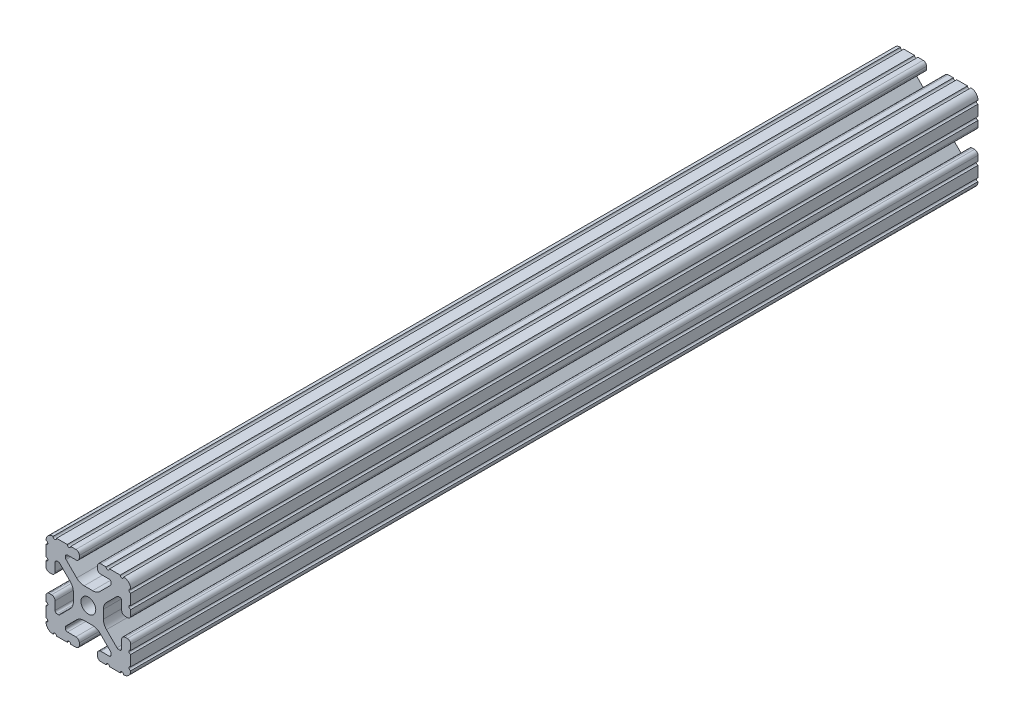
from build123d import *

# Parameters (mm, degrees)
SKETCH1_R      = 3.3274
EXTRUDE1_DEPTH = 381


with BuildPart() as part:
    # Sketch1 → Extrude1 (new body)
    with BuildSketch(Plane.XY):
        with BuildLine():
            Line((-10.022898969, 12.91475973), (-5.252158105, 8.144007132))
            ThreePointArc((-5.252158105, 8.144007132), (-3.715177372, 7.117027388), (-1.902183975, 6.7564))
            Line((-1.902183975, 6.7564), (1.902183975, 6.7564))
            ThreePointArc((1.902183975, 6.7564), (3.715177372, 7.117027388), (5.252158105, 8.144007132))
            Line((5.252158105, 8.144007132), (10.022898969, 12.91475973))
            ThreePointArc((10.022898969, 12.91475973), (10.218362387, 13.207291992), (10.287, 13.552357131))
            Line((10.287, 13.552357131), (10.287, 14.0843))
            ThreePointArc((10.287, 14.0843), (10.022898185, 14.721898185), (9.3853, 14.986))
            Line((9.3853, 14.986), (5.617617549, 14.986))
            ThreePointArc((5.617617549, 14.986), (4.519044045, 15.441044045), (4.064, 16.539617549))
            Line((4.064, 16.539617549), (4.064, 17.496382451))
            ThreePointArc((4.064, 17.496382451), (4.519044045, 18.594955955), (5.617617549, 19.05))
            Line((5.617617549, 19.05), (7.974178704, 19.05))
            ThreePointArc((7.974178704, 19.05), (8.736178704, 18.288), (9.498178704, 19.05))
            Line((9.498178704, 19.05), (14.327719207, 19.05))
            ThreePointArc((14.327719207, 19.05), (15.087603123, 18.231251131), (15.847487039, 19.05))
            ThreePointArc((15.847487039, 19.05), (18.120176289, 18.120192083), (19.05, 15.847509295))
            ThreePointArc((19.05, 15.847509295), (18.231250992, 15.08762539), (19.05, 14.327741484))
            Line((19.05, 14.327741484), (19.05, 9.496091471))
            ThreePointArc((19.05, 9.496091471), (18.231250992, 8.736207565), (19.05, 7.97632366))
            Line((19.05, 7.97632366), (19.05, 5.617617549))
            ThreePointArc((19.05, 5.617617549), (18.594955955, 4.519044045), (17.496382451, 4.064))
            Line((17.496382451, 4.064), (16.539617549, 4.064))
            ThreePointArc((16.539617549, 4.064), (15.441044045, 4.519044045), (14.986, 5.617617549))
            Line((14.986, 5.617617549), (14.986, 9.385342516))
            ThreePointArc((14.986, 9.385342516), (14.721898185, 10.022940701), (14.0843, 10.287042516))
            Line((14.0843, 10.287042516), (13.516042086, 10.287042516))
            ThreePointArc((13.516042086, 10.287042516), (13.170975923, 10.218404478), (12.878443117, 10.022939917))
            Line((12.878443117, 10.022939917), (8.14758008, 5.292065243))
            ThreePointArc((8.14758008, 5.292065243), (7.117955879, 3.751120653), (6.7564, 1.933453584))
            Line((6.7564, 1.933453584), (6.7564, -1.933453584))
            ThreePointArc((6.7564, -1.933453584), (7.117955879, -3.751120653), (8.14758008, -5.292065243))
            Line((8.14758008, -5.292065243), (12.878443117, -10.022939917))
            ThreePointArc((12.878443117, -10.022939917), (13.170975923, -10.218404478), (13.516042086, -10.287042516))
            Line((13.516042086, -10.287042516), (14.0843, -10.287042516))
            ThreePointArc((14.0843, -10.287042516), (14.721898185, -10.022940701), (14.986, -9.385342516))
            Line((14.986, -9.385342516), (14.986, -5.617617549))
            ThreePointArc((14.986, -5.617617549), (15.441044045, -4.519044045), (16.539617549, -4.064))
            Line((16.539617549, -4.064), (17.496382451, -4.064))
            ThreePointArc((17.496382451, -4.064), (18.594955955, -4.519044045), (19.05, -5.617617549))
            Line((19.05, -5.617617549), (19.05, -7.976318491))
            ThreePointArc((19.05, -7.976318491), (18.231250992, -8.736202396), (19.05, -9.496086302))
            Line((19.05, -9.496086302), (19.05, -14.32774291))
            ThreePointArc((19.05, -14.32774291), (18.231250992, -15.087626816), (19.05, -15.847510721))
            ThreePointArc((19.05, -15.847510721), (18.120175716, -18.120192644), (15.847486868, -19.05))
            ThreePointArc((15.847486868, -19.05), (15.087602952, -18.231251131), (14.327719036, -19.05))
            Line((14.327719036, -19.05), (9.496062448, -19.05))
            ThreePointArc((9.496062448, -19.05), (8.736178532, -18.231251131), (7.976294616, -19.05))
            Line((7.976294616, -19.05), (5.617617549, -19.05))
            ThreePointArc((5.617617549, -19.05), (4.519044045, -18.594955955), (4.064, -17.496382451))
            Line((4.064, -17.496382451), (4.064, -16.539617549))
            ThreePointArc((4.064, -16.539617549), (4.519044045, -15.441044045), (5.617617549, -14.986))
            Line((5.617617549, -14.986), (9.3853, -14.986))
            ThreePointArc((9.3853, -14.986), (10.022898185, -14.721898185), (10.287, -14.0843))
            Line((10.287, -14.0843), (10.287, -13.552357131))
            ThreePointArc((10.287, -13.552357131), (10.218362387, -13.207291992), (10.022898969, -12.91475973))
            Line((10.022898969, -12.91475973), (5.252158105, -8.144007132))
            ThreePointArc((5.252158105, -8.144007132), (3.715177372, -7.117027388), (1.902183975, -6.7564))
            Line((1.902183975, -6.7564), (-1.902183975, -6.7564))
            ThreePointArc((-1.902183975, -6.7564), (-3.715177372, -7.117027388), (-5.252158105, -8.144007132))
            Line((-5.252158105, -8.144007132), (-10.022898969, -12.91475973))
            ThreePointArc((-10.022898969, -12.91475973), (-10.218362387, -13.207291992), (-10.287, -13.552357131))
            Line((-10.287, -13.552357131), (-10.287, -14.0843))
            ThreePointArc((-10.287, -14.0843), (-10.022898185, -14.721898185), (-9.3853, -14.986))
            Line((-9.3853, -14.986), (-5.617617549, -14.986))
            ThreePointArc((-5.617617549, -14.986), (-4.519044045, -15.441044045), (-4.064, -16.539617549))
            Line((-4.064, -16.539617549), (-4.064, -17.496382451))
            ThreePointArc((-4.064, -17.496382451), (-4.519044045, -18.594955955), (-5.617617549, -19.05))
            Line((-5.617617549, -19.05), (-7.976294616, -19.05))
            ThreePointArc((-7.976294616, -19.05), (-8.736178532, -18.231251131), (-9.496062448, -19.05))
            Line((-9.496062448, -19.05), (-14.327719036, -19.05))
            ThreePointArc((-14.327719036, -19.05), (-15.087602952, -18.231251131), (-15.847486868, -19.05))
            ThreePointArc((-15.847486868, -19.05), (-18.120175716, -18.120192644), (-19.05, -15.847510721))
            ThreePointArc((-19.05, -15.847510721), (-18.231250992, -15.087626816), (-19.05, -14.32774291))
            Line((-19.05, -14.32774291), (-19.05, -9.496086302))
            ThreePointArc((-19.05, -9.496086302), (-18.231250992, -8.736202396), (-19.05, -7.976318491))
            Line((-19.05, -7.976318491), (-19.05, -5.617617549))
            ThreePointArc((-19.05, -5.617617549), (-18.594955955, -4.519044045), (-17.496382451, -4.064))
            Line((-17.496382451, -4.064), (-16.539617549, -4.064))
            ThreePointArc((-16.539617549, -4.064), (-15.441044045, -4.519044045), (-14.986, -5.617617549))
            Line((-14.986, -5.617617549), (-14.986, -9.385342516))
            ThreePointArc((-14.986, -9.385342516), (-14.721898185, -10.022940701), (-14.0843, -10.287042516))
            Line((-14.0843, -10.287042516), (-13.516042086, -10.287042516))
            ThreePointArc((-13.516042086, -10.287042516), (-13.170975923, -10.218404478), (-12.878443117, -10.022939917))
            Line((-12.878443117, -10.022939917), (-8.14758008, -5.292065243))
            ThreePointArc((-8.14758008, -5.292065243), (-7.117955879, -3.751120653), (-6.7564, -1.933453584))
            Line((-6.7564, -1.933453584), (-6.7564, 1.933453584))
            ThreePointArc((-6.7564, 1.933453584), (-7.117955879, 3.751120653), (-8.14758008, 5.292065243))
            Line((-8.14758008, 5.292065243), (-12.878443117, 10.022939917))
            ThreePointArc((-12.878443117, 10.022939917), (-13.170975923, 10.218404478), (-13.516042086, 10.287042516))
            Line((-13.516042086, 10.287042516), (-14.0843, 10.287042516))
            ThreePointArc((-14.0843, 10.287042516), (-14.721898185, 10.022940701), (-14.986, 9.385342516))
            Line((-14.986, 9.385342516), (-14.986, 5.617617549))
            ThreePointArc((-14.986, 5.617617549), (-15.441044045, 4.519044045), (-16.539617549, 4.064))
            Line((-16.539617549, 4.064), (-17.496382451, 4.064))
            ThreePointArc((-17.496382451, 4.064), (-18.594955955, 4.519044045), (-19.05, 5.617617549))
            Line((-19.05, 5.617617549), (-19.05, 7.97632366))
            ThreePointArc((-19.05, 7.97632366), (-18.231250992, 8.736207565), (-19.05, 9.496091471))
            Line((-19.05, 9.496091471), (-19.05, 14.327741484))
            ThreePointArc((-19.05, 14.327741484), (-18.231250992, 15.08762539), (-19.05, 15.847509295))
            ThreePointArc((-19.05, 15.847509295), (-18.120176289, 18.120192083), (-15.847487039, 19.05))
            ThreePointArc((-15.847487039, 19.05), (-15.087603123, 18.231251131), (-14.327719207, 19.05))
            Line((-14.327719207, 19.05), (-9.498178704, 19.05))
            ThreePointArc((-9.498178704, 19.05), (-8.736178704, 18.288), (-7.974178704, 19.05))
            Line((-7.974178704, 19.05), (-5.617617549, 19.05))
            ThreePointArc((-5.617617549, 19.05), (-4.519044045, 18.594955955), (-4.064, 17.496382451))
            Line((-4.064, 17.496382451), (-4.064, 16.539617549))
            ThreePointArc((-4.064, 16.539617549), (-4.519044045, 15.441044045), (-5.617617549, 14.986))
            Line((-5.617617549, 14.986), (-9.3853, 14.986))
            ThreePointArc((-9.3853, 14.986), (-10.022898185, 14.721898185), (-10.287, 14.0843))
            Line((-10.287, 14.0843), (-10.287, 13.552357131))
            ThreePointArc((-10.287, 13.552357131), (-10.218362387, 13.207291992), (-10.022898969, 12.91475973))
        make_face()
        Circle(SKETCH1_R, mode=Mode.SUBTRACT)
    extrude(amount=-EXTRUDE1_DEPTH)


solid = part.part
